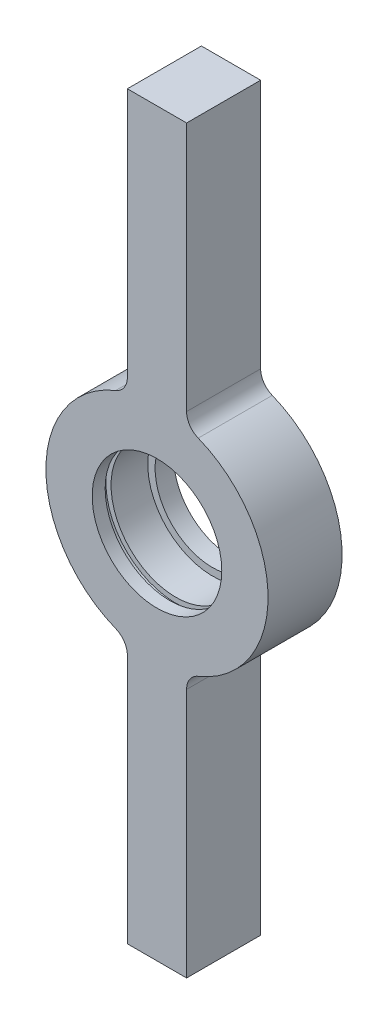
from build123d import *

# Parameters (mm, degrees)
SKETCH1_R           = 30
SKETCH1_R_2         = 15.5
BOSS_EXTRUDE1_DEPTH = 10
BOSS_EXTRUDE2_DEPTH = 10
SKETCH3_W           = 15
SKETCH3_H           = 2
SKETCH4_W           = 1.6
SKETCH4_H           = 1.9
FILLET1_R           = 5


with BuildPart() as part:
    # Sketch1 → Boss-Extrude1 (new, symmetric)
    with BuildSketch(Plane.XY):
        Circle(SKETCH1_R)
        Circle(SKETCH1_R_2, mode=Mode.SUBTRACT)
    extrude(amount=BOSS_EXTRUDE1_DEPTH, both=True)

    # Sketch2 → Boss-Extrude2 (add, symmetric)
    with BuildSketch(Plane.XY):
        Polygon((-8, 100), (8, 100), (8, 28.91366459), (0, 30), (-8, 28.91366459), align=None)
    boss_extrude2 = extrude(amount=BOSS_EXTRUDE2_DEPTH, both=True)

    # Mirror1: Boss-Extrude2 across plane
    add(boss_extrude2.mirror(Plane.ZX))

    # Sketch3 → Cut-Revolve1 (revolve, cut)
    with BuildSketch(Plane(origin=(0, 0, 0), x_dir=(0, 0, -1), z_dir=(1, 0, 0)), mode=Mode.PRIVATE) as cut_revolve1_sk:
        with Locations((-2.5, 16.5)):
            Rectangle(SKETCH3_W, SKETCH3_H)
    revolve(cut_revolve1_sk.sketch.rotate(Axis((0, 0, 0), (0, 0, -1)), 90), axis=Axis((0, 0, 0), (0, 0, -1)), mode=Mode.SUBTRACT)

    # Sketch4 → Cut-Revolve2 (revolve, cut)
    with BuildSketch(Plane(origin=(0, 0, 0), x_dir=(0, 0, -1), z_dir=(1, 0, 0)), mode=Mode.PRIVATE) as cut_revolve2_sk:
        with Locations((-5.7, 17.95)):
            Rectangle(SKETCH4_W, SKETCH4_H)
    revolve(cut_revolve2_sk.sketch.rotate(Axis((0, 0, 0), (0, 0, -1)), 90), axis=Axis((0, 0, 0), (0, 0, -1)), mode=Mode.SUBTRACT)

    # Fillet1
    fillet1_edges = [part.edges().sort_by_distance(p)[0] for p in [
        (8, 28.91366459, 0),
        (-8, 28.91366459, 0),
        (8, -28.91366459, 0),
        (-8, -28.91366459, 0),
    ]]
    fillet(fillet1_edges, radius=FILLET1_R)


solid = part.part
